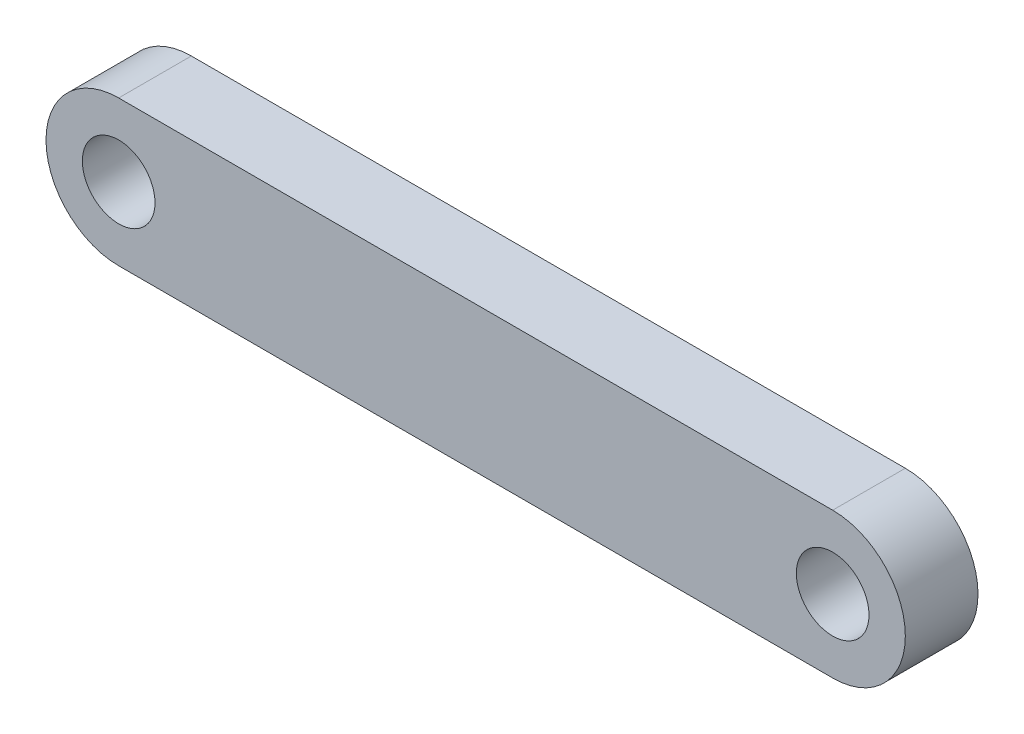
from build123d import *

# Parameters (mm, degrees)
SKETCH1_R           = 1
BOSS_EXTRUDE1_DEPTH = 2


with BuildPart() as part:
    # Sketch1 → Boss-Extrude1 (new body)
    with BuildSketch(Plane.XY):
        with BuildLine():
            Line((0, 2), (19.65, 2))
            ThreePointArc((19.65, 2), (21.65, 0), (19.65, -2))
            Line((19.65, -2), (0, -2))
            ThreePointArc((0, -2), (-2, 0), (0, 2))
        make_face()
        Circle(SKETCH1_R, mode=Mode.SUBTRACT)
        with Locations((19.65, 0)):
            Circle(SKETCH1_R, mode=Mode.SUBTRACT)
    extrude(amount=BOSS_EXTRUDE1_DEPTH)


solid = part.part
